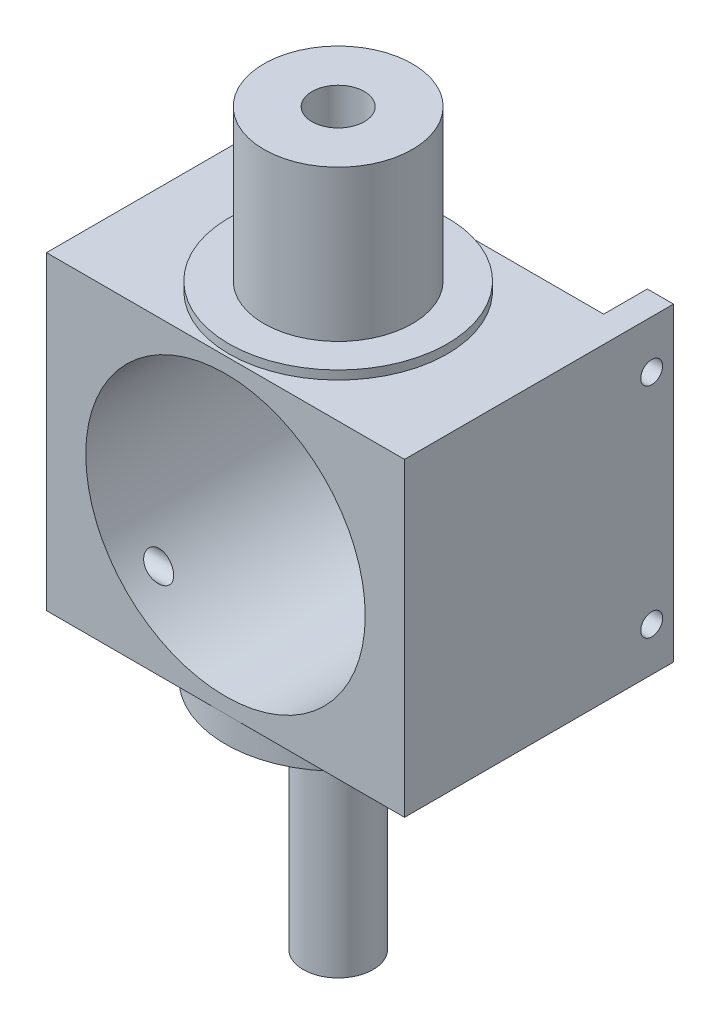
from build123d import *

# Parameters (mm, degrees)
BOSS_EXTRUDE1_DEPTH     = 35.5
SKETCH2_R               = 12.9
BOSS_EXTRUDE2_DEPTH     = 3
SKETCH3_R               = 4
BOSS_EXTRUDE3_DEPTH     = 26.8
SKETCH4_R               = 12.5
BOSS_EXTRUDE4_DEPTH     = 1
SKETCH5_R               = 8.5
BOSS_EXTRUDE5_DEPTH     = 17.28
CUT_EXTRUDE1_REACH      = 83.306
SKETCH6_R               = 16
CUT_EXTRUDE2_REACH      = 96.36
CUT_EXTRUDE2_END_RADIUS = 16
SKETCH7_R               = 3
CUT_EXTRUDE3_REACH      = 80.627
SKETCH8_R               = 1.25
CUT_EXTRUDE4_REACH      = 79.105
SKETCH9_R               = 1.25
BODY_MOVE_COPY2_ANGLE   = 120


with BuildPart() as part:
    # Sketch1 → Boss-Extrude1 (new body)
    with BuildSketch(Plane.XY):
        Polygon((15.4, 41), (-15.4, 41), (-15.4, 0), (15.4, 0), (15.4, 3), (10.4, 3), (10.4, 38), (15.4, 38), align=None)
    extrude(amount=BOSS_EXTRUDE1_DEPTH)

    # Sketch2 → Boss-Extrude2 (add)
    with BuildSketch(Plane.XY.offset(35.5)):
        with Locations((-2.5, 20.5)):
            Circle(SKETCH2_R)
    extrude(amount=BOSS_EXTRUDE2_DEPTH)

    # Sketch3 → Boss-Extrude3 (add)
    with BuildSketch(Plane.XY.offset(38.5)):
        with Locations((-2.5, 20.5)):
            Circle(SKETCH3_R)
    extrude(amount=BOSS_EXTRUDE3_DEPTH)

    # Sketch4 → Boss-Extrude4 (add)
    with BuildSketch(Plane(origin=(0, 0, 0), x_dir=(-1, 0, 0), z_dir=(0, 0, -1))):
        with Locations((2.5, 20.5)):
            Circle(SKETCH4_R)
    extrude(amount=BOSS_EXTRUDE4_DEPTH)

    # Sketch5 → Boss-Extrude5 (add)
    with BuildSketch(Plane(origin=(0, 0, -1), x_dir=(-1, 0, 0), z_dir=(0, 0, -1))):
        with Locations((2.5, 20.5)):
            Circle(SKETCH5_R)
    extrude(amount=BOSS_EXTRUDE5_DEPTH)

    # Sketch6 → Cut-Extrude1 (cut, up to next)
    with BuildSketch(Plane(origin=(10.4, 0, 0), x_dir=(0, 0, -1), z_dir=(1, 0, 0)), mode=Mode.PRIVATE) as cut_extrude1_sk1:
        with Locations((-17.75, 20.5)):
            Circle(SKETCH6_R)
    cut_extrude1_tool1 = extrude(cut_extrude1_sk1.sketch, amount=-CUT_EXTRUDE1_REACH, mode=Mode.PRIVATE) & part.part
    add(cut_extrude1_tool1.solids().sort_by_distance((10.4, 20.5, 17.75))[0], mode=Mode.SUBTRACT)

    # Cut-Extrude2: up to this cylinder (the profile starts outside it)
    cut_extrude2_end = Plane(origin=(-2.5, 20.5, 17.75), z_dir=(1, 0, 0)) * Cylinder(CUT_EXTRUDE2_END_RADIUS, 225.72, mode=Mode.PRIVATE)
    # Sketch7 → Cut-Extrude2 (cut, up to the surface)
    with BuildSketch(Plane(origin=(0, 0, -18.28), x_dir=(-1, 0, 0), z_dir=(0, 0, -1)), mode=Mode.PRIVATE) as cut_extrude2_sk1:
        with Locations((2.5, 20.5)):
            Circle(SKETCH7_R)
    cut_extrude2_tool1 = extrude(cut_extrude2_sk1.sketch, amount=-CUT_EXTRUDE2_REACH, mode=Mode.PRIVATE) - cut_extrude2_end
    add(cut_extrude2_tool1.solids().sort_by_distance((-2.5, 20.5, -18.28))[0], mode=Mode.SUBTRACT)

    # Sketch8 → Cut-Extrude3 (cut, up to next)
    with BuildSketch(Plane.XZ, mode=Mode.PRIVATE) as cut_extrude3_sk1:
        with Locations(Location((12.9, 30.5, 0), (0, 0, 270))):
            Circle(SKETCH8_R)
    cut_extrude3_tool1 = extrude(cut_extrude3_sk1.sketch, amount=-CUT_EXTRUDE3_REACH, mode=Mode.PRIVATE) & part.part
    # Sketch8 → Cut-Extrude3 (cut, up to next)
    with BuildSketch(Plane.XZ, mode=Mode.PRIVATE) as cut_extrude3_sk2:
        with Locations(Location((12.9, 5.5, 0), (0, 0, 270))):
            Circle(SKETCH8_R)
    cut_extrude3_tool2 = extrude(cut_extrude3_sk2.sketch, amount=-CUT_EXTRUDE3_REACH, mode=Mode.PRIVATE) & part.part
    # Sketch8 → Cut-Extrude3 (cut, up to next)
    with BuildSketch(Plane.XZ, mode=Mode.PRIVATE) as cut_extrude3_sk3:
        with Locations(Location((9.4, 18.45, 0), (0, 0, 270))):
            Circle(SKETCH8_R)
    cut_extrude3_tool3 = extrude(cut_extrude3_sk3.sketch, amount=-CUT_EXTRUDE3_REACH, mode=Mode.PRIVATE) & part.part
    # Sketch8 → Cut-Extrude3 (cut, up to next)
    with BuildSketch(Plane.XZ, mode=Mode.PRIVATE) as cut_extrude3_sk4:
        with Locations(Location((-11.4, 28.65, 0), (0, 0, 270))):
            Circle(SKETCH8_R)
    cut_extrude3_tool4 = extrude(cut_extrude3_sk4.sketch, amount=-CUT_EXTRUDE3_REACH, mode=Mode.PRIVATE) & part.part
    add(cut_extrude3_tool1.solids().sort_by_distance((12.9, 0, 30.5))[0], mode=Mode.SUBTRACT)
    add(cut_extrude3_tool2.solids().sort_by_distance((12.9, 0, 5.5))[0], mode=Mode.SUBTRACT)
    add(cut_extrude3_tool3.solids().sort_by_distance((9.4, 0, 18.45))[0], mode=Mode.SUBTRACT)
    add(cut_extrude3_tool4.solids().sort_by_distance((-11.4, 0, 28.65))[0], mode=Mode.SUBTRACT)

    # Sketch9 → Cut-Extrude4 (cut, up to next)
    with BuildSketch(Plane.XZ.offset(-38), mode=Mode.PRIVATE) as cut_extrude4_sk1:
        with Locations(Location((12.9, 30.5, 0), (0, 0, 270))):
            Circle(SKETCH9_R)
    cut_extrude4_tool1 = extrude(cut_extrude4_sk1.sketch, amount=-CUT_EXTRUDE4_REACH, mode=Mode.PRIVATE) & part.part
    # Sketch9 → Cut-Extrude4 (cut, up to next)
    with BuildSketch(Plane.XZ.offset(-38), mode=Mode.PRIVATE) as cut_extrude4_sk2:
        with Locations(Location((12.9, 5.5, 0), (0, 0, 270))):
            Circle(SKETCH9_R)
    cut_extrude4_tool2 = extrude(cut_extrude4_sk2.sketch, amount=-CUT_EXTRUDE4_REACH, mode=Mode.PRIVATE) & part.part
    add(cut_extrude4_tool1.solids().sort_by_distance((12.9, 38, 30.5))[0], mode=Mode.SUBTRACT)
    add(cut_extrude4_tool2.solids().sort_by_distance((12.9, 38, 5.5))[0], mode=Mode.SUBTRACT)


with BuildPart() as part_1:
    # Body-Move/Copy1: moved
    add(part.part.moved(Location((2.5, -20.5, -17.75))))


with BuildPart() as part_2:
    # Body-Move/Copy2: moved
    add(part_1.part.rotate(Axis((0, 0, 0), (0.5773502691896272, 0.5773502691896252, -0.5773502691896252)), BODY_MOVE_COPY2_ANGLE))


solid = part_2.part
